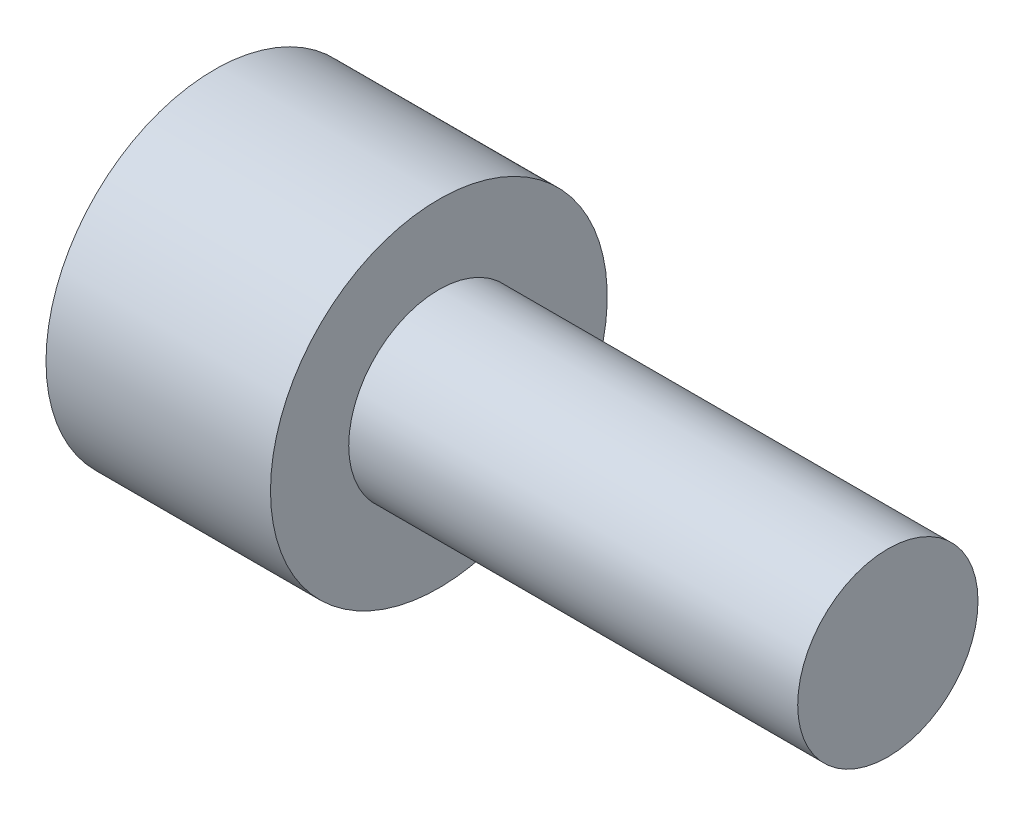
from build123d import *

# Parameters (mm, degrees)
SOCKET_DEPTH = 3.175


with BuildPart() as part:
    # Screw Sketch → Screw (revolve)
    with BuildSketch(Plane.XY):
        Polygon((-6.35, 0), (-6.35, 4.7625), (0, 4.7625), (0, 2.55), (12.7, 2.55), (12.7, 0), align=None)
    revolve(axis=Axis((-1000, 0, 0), (1, 0, 0)))

    # Socket Sketch → Socket (cut)
    with BuildSketch(Plane(origin=(-6.35, 0, 0), x_dir=(0, 0, -1), z_dir=(1, 0, 0))):
        Polygon((2.748187281, 0), (1.374093641, 2.38), (-1.374093641, 2.38), (-2.748187281, 0), (-1.374093641, -2.38), (1.374093641, -2.38), align=None)
    extrude(amount=SOCKET_DEPTH, mode=Mode.SUBTRACT)


solid = part.part
